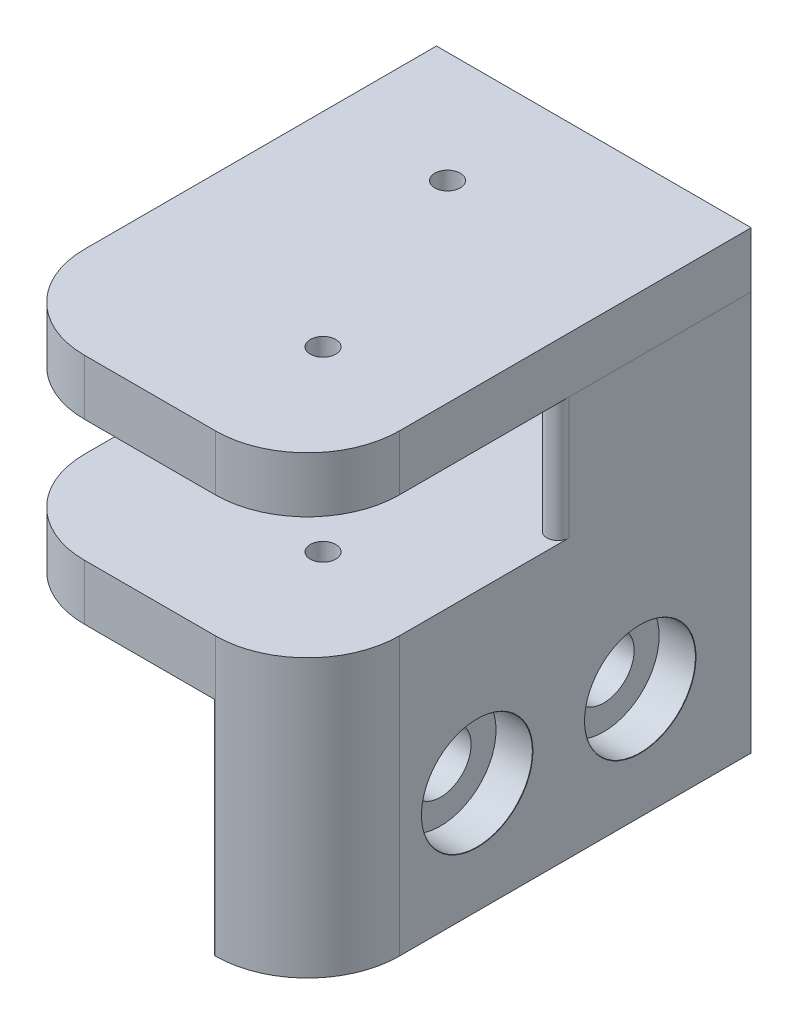
from build123d import *

# Parameters (mm, degrees)
SKETCH1_W                                  = 28.37
SKETCH1_H                                  = 40
BOSS_EXTRUDE1_DEPTH                        = 5
SKETCH2_R                                  = 1.148523169
CUT_EXTRUDE1_DEPTH                         = 26.024272717
SKETCH4_W                                  = 8.37
SKETCH4_H                                  = 40
BOSS_EXTRUDE2_DEPTH                        = 20
BOSS_EXTRUDE3_DEPTH                        = 11
SKETCH6_W                                  = 28.37
SKETCH6_H                                  = 40
BOSS_EXTRUDE4_DEPTH                        = 5
SKETCH3_R                                  = 1.15
CUT_EXTRUDE2_DEPTH                         = 33.283342841
SKETCH7_R                                  = 1.15
CUT_EXTRUDE3_DEPTH                         = 5
FILLET1_R                                  = 1
FILLET2_R                                  = 8.3
CBORE_FOR_M5_CHEESE_HEAD_SCREW1_AT_2_COUNT = 2
CBORE_FOR_M5_CHEESE_HEAD_SCREW1_AT_2_PITCH = 14.7


with BuildPart() as part:
    # Sketch1 → Boss-Extrude1 (new body)
    with BuildSketch(Plane(origin=(0, 0, 0), x_dir=(1, 0, 0), z_dir=(0, 1, 0))):
        Rectangle(SKETCH1_W, SKETCH1_H)
    extrude(amount=BOSS_EXTRUDE1_DEPTH)

    # Sketch2 → Cut-Extrude1 (cut, through all)
    with BuildSketch(Plane.XZ):
        with Locations(Location((-3.185, -10, 0), (0, 0, 270))):
            Circle(SKETCH2_R)
    extrude(amount=-CUT_EXTRUDE1_DEPTH, mode=Mode.SUBTRACT)

    # Sketch4 → Boss-Extrude2 (add)
    with BuildSketch(Plane.XZ):
        with Locations((10, 0)):
            Rectangle(SKETCH4_W, SKETCH4_H)
    extrude(amount=BOSS_EXTRUDE2_DEPTH)

    # Sketch5 → Boss-Extrude3 (add)
    with BuildSketch(Plane(origin=(0, 5, 0), x_dir=(1, 0, 0), z_dir=(0, 1, 0))):
        Polygon((14.185, 20), (6.815, 20), (6.815, 12.181164673), (14.185, 0), align=None)
    extrude(amount=BOSS_EXTRUDE3_DEPTH)

    # Sketch6 → Boss-Extrude4 (add)
    with BuildSketch(Plane(origin=(0, 16, 0), x_dir=(1, 0, 0), z_dir=(0, 1, 0))):
        Rectangle(SKETCH6_W, SKETCH6_H)
    extrude(amount=BOSS_EXTRUDE4_DEPTH)

    # Sketch3 → Cut-Extrude2 (cut, through all)
    with BuildSketch(Plane.XZ):
        with Locations(Location((4.185, 8.592554962, 0), (0, 0, 270))):
            Circle(SKETCH3_R)
    extrude(amount=-CUT_EXTRUDE2_DEPTH, mode=Mode.SUBTRACT)

    # Sketch7 → Cut-Extrude3 (cut)
    with BuildSketch(Plane.XZ.offset(-16)):
        with Locations(Location((-3.185, -10, 0), (0, 0, 270))):
            Circle(SKETCH7_R)
        with Locations(Location((4.185, 8.592554962, 0), (0, 0, 270))):
            Circle(SKETCH7_R)
    extrude(amount=-CUT_EXTRUDE3_DEPTH, mode=Mode.SUBTRACT)

    # Fillet1
    fillet1_edges = [part.edges().sort_by_distance(p)[0] for p in [
        (14.185, 10.5, 0),
    ]]
    fillet(fillet1_edges, radius=FILLET1_R)

    # Fillet2
    fillet2_edges = [part.edges().sort_by_distance(p)[0] for p in [
        (14.185, 18.5, 20),
        (-14.185, 18.5, 20),
        (14.185, -7.5, 20),
        (-14.185, 2.5, 20),
    ]]
    fillet(fillet2_edges, radius=FILLET2_R)


with BuildPart() as body_2:
    # Split1: the piece on the far side of the plane
    add(part.part)
    split(bisect_by=Plane(origin=(0, 16, 0), x_dir=(0, 0, -1), z_dir=(0, -1, 0)), keep=Keep.BOTTOM)


with BuildPart() as part_1:
    add(part.part)

    # Split1
    split(bisect_by=Plane(origin=(0, 16, 0), x_dir=(0, 0, -1), z_dir=(0, -1, 0)), keep=Keep.TOP)

    # Sketch10 → CBORE for M5 Cheese Head Screw1 (revolve, cut)
    with BuildSketch(Plane(origin=(14.185, -10, 4.7), x_dir=(0, 0, -1), z_dir=(0, 1, 0))):
        Polygon((0, 0), (0, 8.37), (2.75, 8.37), (2.75, 3.3), (5, 3.3), (5, 0.025), (5.025, 0), align=None)
    cbore_for_m5_cheese_head_screw1 = revolve(axis=Axis((20.535, -10, 4.7), (-1, 0, 0)), mode=Mode.SUBTRACT)

    # CBORE for M5 Cheese Head Screw1 at 2: CBORE for M5 Cheese Head Screw1 ×2
    with Locations(*[(0, 0, -i * CBORE_FOR_M5_CHEESE_HEAD_SCREW1_AT_2_PITCH) for i in range(1, CBORE_FOR_M5_CHEESE_HEAD_SCREW1_AT_2_COUNT)]):
        add(cbore_for_m5_cheese_head_screw1, mode=Mode.SUBTRACT)


solid = Compound([body_2.part, part_1.part])
